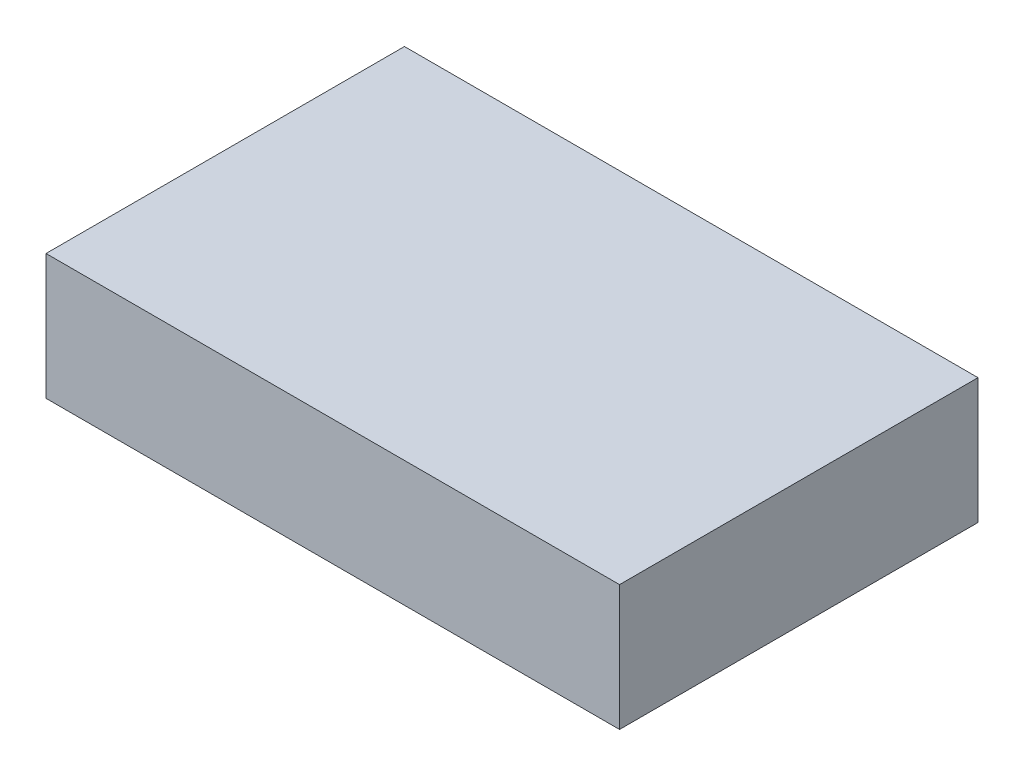
from build123d import *

# Parameters (mm, degrees)
SKETCH1_W           = 406.4
SKETCH1_H           = 254
BOSS_EXTRUDE1_DEPTH = 88.9


with BuildPart() as part:
    # Sketch1 → Boss-Extrude1 (new body)
    with BuildSketch(Plane(origin=(0, 0, 0), x_dir=(1, 0, 0), z_dir=(0, 1, 0))):
        Rectangle(SKETCH1_W, SKETCH1_H)
    extrude(amount=BOSS_EXTRUDE1_DEPTH)


solid = part.part
